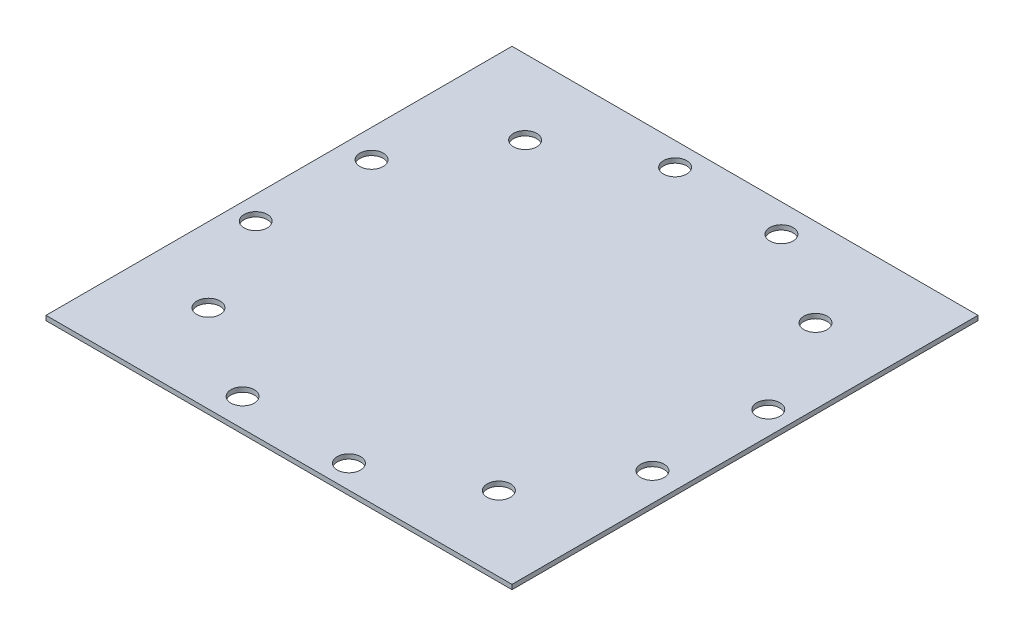
from build123d import *

# Parameters (mm, degrees)
SKETCH1_W           = 254
SKETCH1_H           = 254
BOSS_EXTRUDE1_DEPTH = 2.54
SKETCH2_R           = 6.35
CUT_EXTRUDE1_DEPTH  = 180.623082036


with BuildPart() as part:
    # Sketch1 → Boss-Extrude1 (new body)
    with BuildSketch(Plane(origin=(0, 0, 0), x_dir=(1, 0, 0), z_dir=(0, 1, 0))):
        Rectangle(SKETCH1_W, SKETCH1_H)
    extrude(amount=BOSS_EXTRUDE1_DEPTH)

    # Sketch2 → Cut-Extrude1 (cut, through all)
    with BuildSketch(Plane(origin=(0, 2.54, 0), x_dir=(1, 0, 0), z_dir=(0, 1, 0))):
        with Locations(Location((114.3, 25.4, 0), (0, 0, 270))):
            Circle(SKETCH2_R)
        with Locations(Location((111.686703653, -35.152954744, 0), (0, 0, 270))):
            Circle(SKETCH2_R)
        with Locations(Location((79.147045256, -86.286703653, 0), (0, 0, 270))):
            Circle(SKETCH2_R)
        with Locations(Location((25.4, -114.3, 0), (0, 0, 270))):
            Circle(SKETCH2_R)
        with Locations(Location((-35.152954744, -111.686703653, 0), (0, 0, 270))):
            Circle(SKETCH2_R)
        with Locations(Location((-86.286703653, -79.147045256, 0), (0, 0, 270))):
            Circle(SKETCH2_R)
        with Locations(Location((-114.3, -25.4, 0), (0, 0, 270))):
            Circle(SKETCH2_R)
        with Locations(Location((-111.686703653, 35.152954744, 0), (0, 0, 270))):
            Circle(SKETCH2_R)
        with Locations(Location((-79.147045256, 86.286703653, 0), (0, 0, 270))):
            Circle(SKETCH2_R)
        with Locations(Location((-25.4, 114.3, 0), (0, 0, 270))):
            Circle(SKETCH2_R)
        with Locations(Location((35.152954744, 111.686703653, 0), (0, 0, 270))):
            Circle(SKETCH2_R)
        with Locations(Location((86.286703653, 79.147045256, 0), (0, 0, 270))):
            Circle(SKETCH2_R)
    extrude(amount=-CUT_EXTRUDE1_DEPTH, mode=Mode.SUBTRACT)


solid = part.part
